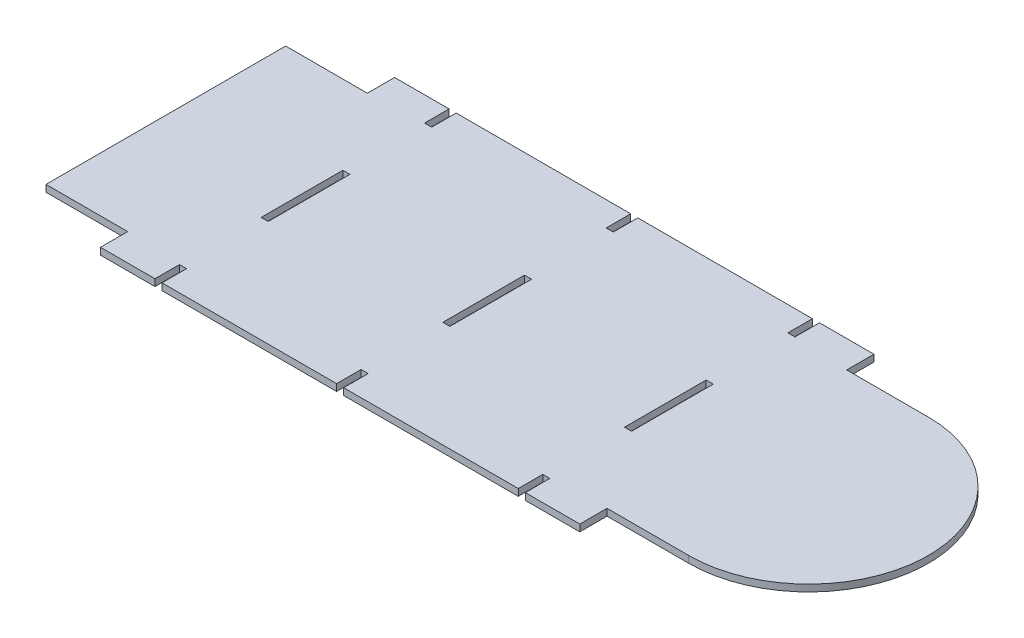
from build123d import *

# Parameters (mm, degrees)
SKETCH1_W           = 3.302
SKETCH1_H           = 38.1
BOSS_EXTRUDE1_DEPTH = 3.175
SKETCH2_R           = 0.627804746
CUT_EXTRUDE1_DEPTH  = 2.54


with BuildPart() as part:
    # Sketch1 → Boss-Extrude1 (new body)
    with BuildSketch(Plane(origin=(0, 0, 0), x_dir=(1, 0, 0), z_dir=(0, 1, 0))):
        with BuildLine():
            Line((-149.86, -55.88), (-149.86, 55.88))
            Line((-149.86, 55.88), (-111.76, 55.88))
            Line((-111.76, 55.88), (-111.76, 68.58))
            Line((-111.76, 68.58), (-86.36, 68.58))
            Line((-86.36, 68.58), (-86.36, 57.15))
            Line((-86.36, 57.15), (-83.058, 57.15))
            Line((-83.058, 57.15), (-83.058, 68.58))
            Line((-83.058, 68.58), (-1.651, 68.58))
            Line((-1.651, 68.58), (-1.651, 57.15))
            Line((-1.651, 57.15), (1.651, 57.15))
            Line((1.651, 57.15), (1.651, 68.58))
            Line((1.651, 68.58), (83.058, 68.58))
            Line((83.058, 68.58), (83.058, 57.15))
            Line((83.058, 57.15), (86.36, 57.15))
            Line((86.36, 57.15), (86.36, 68.58))
            Line((86.36, 68.58), (111.76, 68.58))
            Line((111.76, 68.58), (111.76, 55.88))
            Line((111.76, 55.88), (149.86, 55.88))
            ThreePointArc((149.86, 55.88), (205.74, 0), (149.86, -55.88))
            Line((149.86, -55.88), (111.76, -55.88))
            Line((111.76, -55.88), (111.76, -68.58))
            Line((111.76, -68.58), (86.36, -68.58))
            Line((86.36, -68.58), (86.36, -57.15))
            Line((86.36, -57.15), (83.058, -57.15))
            Line((83.058, -57.15), (83.058, -68.58))
            Line((83.058, -68.58), (1.651, -68.58))
            Line((1.651, -68.58), (1.651, -57.15))
            Line((1.651, -57.15), (-1.651, -57.15))
            Line((-1.651, -57.15), (-1.651, -68.58))
            Line((-1.651, -68.58), (-83.058, -68.58))
            Line((-83.058, -68.58), (-83.058, -57.15))
            Line((-83.058, -57.15), (-86.36, -57.15))
            Line((-86.36, -57.15), (-86.36, -68.58))
            Line((-86.36, -68.58), (-111.76, -68.58))
            Line((-111.76, -68.58), (-111.76, -55.88))
            Line((-111.76, -55.88), (-149.86, -55.88))
        make_face()
        Rectangle(SKETCH1_W, SKETCH1_H, mode=Mode.SUBTRACT)
        with Locations((-84.709, 0)):
            Rectangle(SKETCH1_W, SKETCH1_H, mode=Mode.SUBTRACT)
        with Locations((84.709, 0)):
            Rectangle(SKETCH1_W, SKETCH1_H, mode=Mode.SUBTRACT)
    extrude(amount=BOSS_EXTRUDE1_DEPTH)

    # Sketch2 → Cut-Extrude1 (cut)
    with BuildSketch(Plane.ZY.offset(149.86)):
        with Locations((0, 1.55575)):
            Circle(SKETCH2_R)
    extrude(amount=-CUT_EXTRUDE1_DEPTH, mode=Mode.SUBTRACT)


solid = part.part
